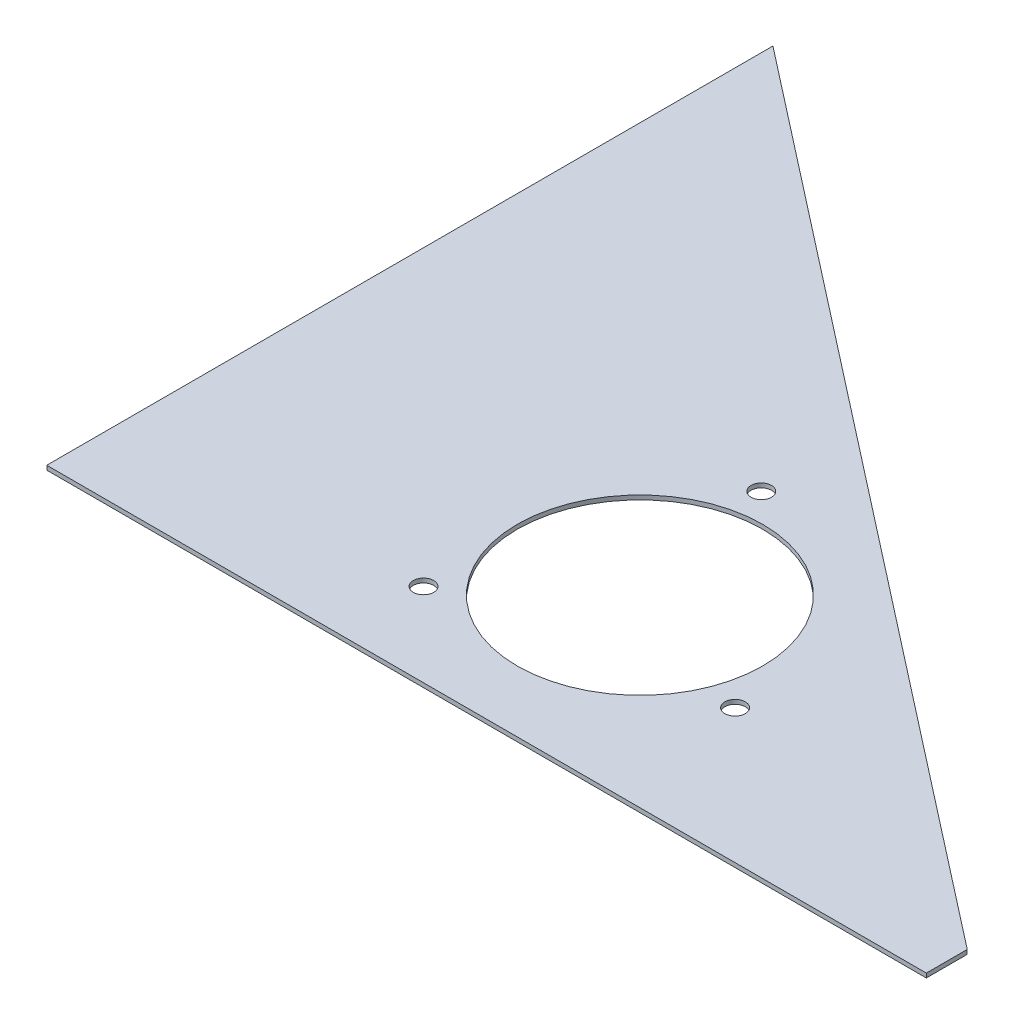
from build123d import *

# Parameters (mm, degrees)
BOSS_EXTRUDE1_DEPTH = 2.65684
SKETCH2_R           = 76.2
CUT_EXTRUDE1_DEPTH  = 709.165228812
SKETCH3_R           = 6.35
CUT_EXTRUDE2_DEPTH  = 709.165228812


with BuildPart() as part:
    # Sketch1 → Boss-Extrude1 (new body)
    with BuildSketch(Plane(origin=(0, 0, 0), x_dir=(1, 0, 0), z_dir=(0, 1, 0))):
        Polygon((0, 450.85), (0, 0), (546.1, 0), (546.1, 25.4), align=None)
    extrude(amount=BOSS_EXTRUDE1_DEPTH)

    # Sketch2 → Cut-Extrude1 (cut, through all)
    with BuildSketch(Plane.XZ):
        with Locations(Location((254, -114.3, 0), (0, 0, 270))):
            Circle(SKETCH2_R)
    extrude(amount=-CUT_EXTRUDE1_DEPTH, mode=Mode.SUBTRACT)

    # Sketch3 → Cut-Extrude2 (cut, through all)
    with BuildSketch(Plane.XZ):
        with Locations(Location((344.060644326, -83.289633288, 0), (0, 0, 270))):
            Circle(SKETCH3_R)
        with Locations(Location((235.82544319, -207.799989223, 0), (0, 0, 270))):
            Circle(SKETCH3_R)
        with Locations(Location((182.113912484, -51.810377489, 0), (0, 0, 270))):
            Circle(SKETCH3_R)
    extrude(amount=-CUT_EXTRUDE2_DEPTH, mode=Mode.SUBTRACT)


solid = part.part
